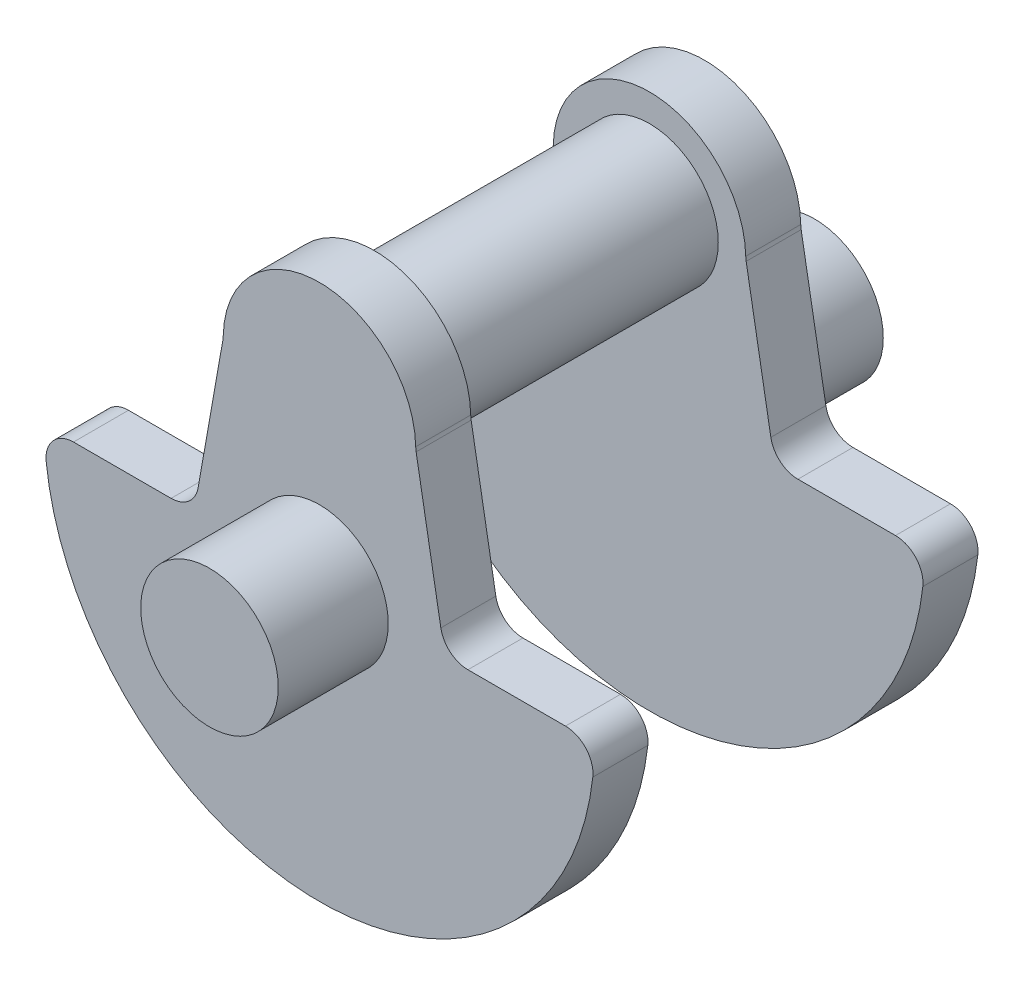
from build123d import *

# Parameters (mm, degrees)
BOSS_EXTRUDE1_DEPTH  = 10
FILLET1_R            = 5
SKETCH2_R            = 12.5
BOSS_EXTRUDE2_DEPTH  = 20
SKETCH3_R            = 12.5
BOSS_EXTRUDE3_DEPTH  = 50
FILLET1_OF_MIRROR1_R = 5


with BuildPart() as part:
    # Sketch1 → Boss-Extrude1 (new body)
    with BuildSketch(Plane.XY):
        with BuildLine():
            Line((-17.5, 30), (-22.789809421, 0))
            Line((-22.789809421, 0), (-50, 0))
            ThreePointArc((-50, 0), (0, -50), (50, 0))
            Line((50, 0), (22.789809421, 0))
            Line((22.789809421, 0), (17.5, 30))
            ThreePointArc((17.5, 30), (0, 47.5), (-17.5, 30))
        make_face()
    boss_extrude1 = extrude(amount=-BOSS_EXTRUDE1_DEPTH)

    # Fillet1
    fillet1_edges = [part.edges().sort_by_distance(p)[0] for p in [
        (-50, 0, -5),
        (-22.789809421, 0, -5),
        (-17.5, 30, -5),
        (17.5, 30, -5),
        (22.789809421, 0, -5),
        (50, 0, -5),
    ]]
    fillet(fillet1_edges, radius=FILLET1_R)

    # Sketch2 → Boss-Extrude2 (add)
    with BuildSketch(Plane.XY):
        Circle(SKETCH2_R)
    boss_extrude2 = extrude(amount=BOSS_EXTRUDE2_DEPTH)

    # Sketch3 → Boss-Extrude3 (add)
    with BuildSketch(Plane(origin=(0, 0, -10), x_dir=(-1, 0, 0), z_dir=(0, 0, -1))):
        with Locations(Location((0, 30, 0), (0, 0, 180))):
            Circle(SKETCH3_R)
    extrude(amount=BOSS_EXTRUDE3_DEPTH)

    # Mirror1: Boss-Extrude1, Boss-Extrude2 across plane
    add(boss_extrude1.mirror(Plane(origin=(0, 0, -35), x_dir=(1, 0, 0), z_dir=(0, 0, -1))))
    add(boss_extrude2.mirror(Plane(origin=(0, 0, -35), x_dir=(1, 0, 0), z_dir=(0, 0, -1))))

    # Fillet1 of Mirror1
    fillet1_of_mirror1_edges = [part.edges().sort_by_distance(p)[0] for p in [
        (-50, 0, -65),
        (-22.789809421, 0, -65),
        (-17.5, 30, -65),
        (17.5, 30, -65),
        (22.789809421, 0, -65),
        (50, 0, -65),
    ]]
    fillet(fillet1_of_mirror1_edges, radius=FILLET1_OF_MIRROR1_R)


solid = part.part
